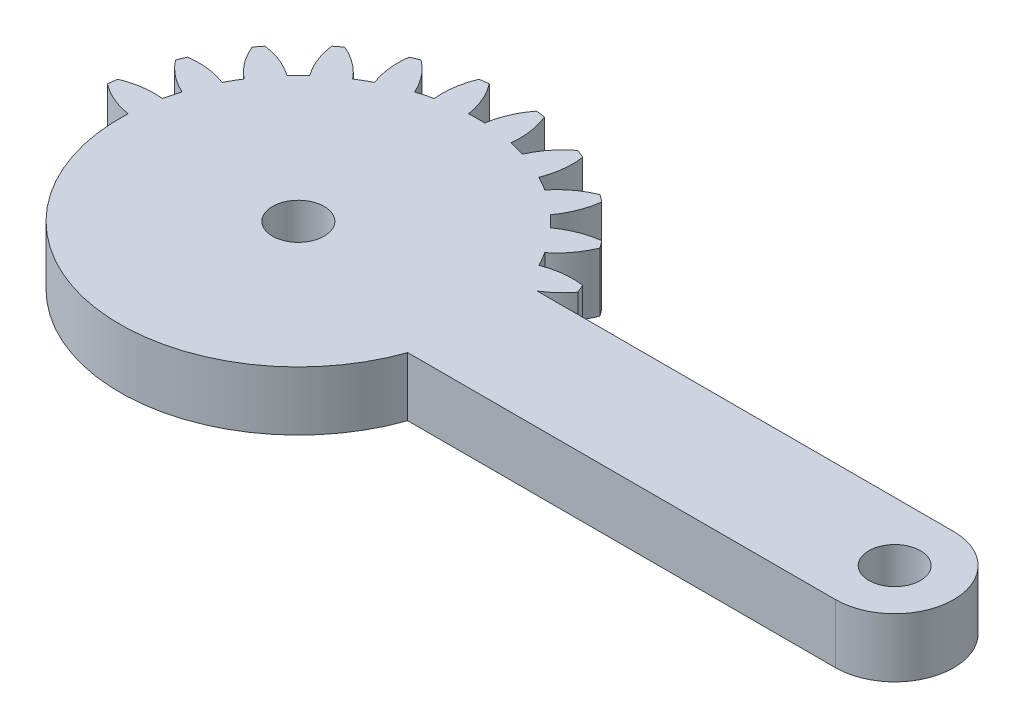
from build123d import *

# Parameters (mm, degrees)
SKETCH1_R           = 1.75
BOSS_EXTRUDE1_DEPTH = 4


with BuildPart() as part:
    # Sketch1 → Boss-Extrude1 (new body)
    with BuildSketch(Plane(origin=(0, 4, 0), x_dir=(1, 0, 0), z_dir=(0, 1, 0))):
        with BuildLine():
            Line((1.305695063, -4), (30.3065745, -4))
            ThreePointArc((30.3065745, -4), (34.3065745, 0), (30.3065745, 4))
            Line((30.3065745, 4), (2.081641936, 4))
            ThreePointArc((2.081641936, 4), (2.861028333, 4.588201733), (3.521749436, 5.30713988))
            ThreePointArc((3.521749436, 5.30713988), (3.405395609, 5.596745198), (3.282888305, 5.883801663))
            ThreePointArc((3.282888305, 5.883801663), (1.93527598, 5.894040025), (0.627094961, 5.57027124))
            ThreePointArc((0.627094961, 5.57027124), (0.366286148, 6.046375), (0.084372603, 6.510293938))
            ThreePointArc((0.084372603, 6.510293938), (1.018855105, 7.48132754), (1.683794586, 8.65351323))
            ThreePointArc((1.683794586, 8.65351323), (1.496450048, 8.903135899), (1.303821399, 9.148703928))
            ThreePointArc((1.303821399, 9.148703928), (-0.000522033, 8.809805691), (-1.180330337, 8.158486898))
            ThreePointArc((-1.180330337, 8.158486898), (-1.555477026, 8.550865528), (-1.947855656, 8.926012217))
            ThreePointArc((-1.947855656, 8.926012217), (-1.296536862, 10.105820521), (-0.957638625, 11.410163953))
            ThreePointArc((-0.957638625, 11.410163953), (-1.203206655, 11.602792602), (-1.452829324, 11.79013714))
            ThreePointArc((-1.452829324, 11.79013714), (-2.625015014, 11.125197659), (-3.596048616, 10.190715157))
            ThreePointArc((-3.596048616, 10.190715157), (-4.059967554, 10.472628702), (-4.536071314, 10.733437515))
            ThreePointArc((-4.536071314, 10.733437515), (-4.212302529, 12.041618533), (-4.222540891, 13.389230859))
            ThreePointArc((-4.222540891, 13.389230859), (-4.509597355, 13.511738163), (-4.799202674, 13.62809199))
            ThreePointArc((-4.799202674, 13.62809199), (-5.759348103, 12.682425791), (-6.455432668, 11.528463019))
            ThreePointArc((-6.455432668, 11.528463019), (-6.976508546, 11.680699536), (-7.503891752, 11.809396783))
            ThreePointArc((-7.503891752, 11.809396783), (-7.529737283, 13.156800143), (-7.888414517, 14.455843809))
            ThreePointArc((-7.888414517, 14.455843809), (-8.197396993, 14.499881098), (-8.507248835, 14.537314892))
            ThreePointArc((-8.507248835, 14.537314892), (-9.18992168, 13.375367565), (-9.563620196, 12.080565177))
            ThreePointArc((-9.563620196, 12.080565177), (-10.106342554, 12.09275), (-10.649064912, 12.080565177))
            ThreePointArc((-10.649064912, 12.080565177), (-11.022763428, 13.375367565), (-11.705436272, 14.537314892))
            ThreePointArc((-11.705436272, 14.537314892), (-12.015288115, 14.499881098), (-12.324270591, 14.455843809))
            ThreePointArc((-12.324270591, 14.455843809), (-12.682947825, 13.156800143), (-12.708793355, 11.809396783))
            ThreePointArc((-12.708793355, 11.809396783), (-13.236176561, 11.680699536), (-13.757252439, 11.528463019))
            ThreePointArc((-13.757252439, 11.528463019), (-14.453337005, 12.682425791), (-15.413482434, 13.62809199))
            ThreePointArc((-15.413482434, 13.62809199), (-15.703087752, 13.511738163), (-15.990144217, 13.389230859))
            ThreePointArc((-15.990144217, 13.389230859), (-16.000382579, 12.041618533), (-15.676613793, 10.733437515))
            ThreePointArc((-15.676613793, 10.733437515), (-16.152717554, 10.472628702), (-16.616636492, 10.190715157))
            ThreePointArc((-16.616636492, 10.190715157), (-17.587670094, 11.125197659), (-18.759855783, 11.79013714))
            ThreePointArc((-18.759855783, 11.79013714), (-19.009478453, 11.602792602), (-19.255046482, 11.410163953))
            ThreePointArc((-19.255046482, 11.410163953), (-18.916148245, 10.105820521), (-18.264829452, 8.926012217))
            ThreePointArc((-18.264829452, 8.926012217), (-18.657208082, 8.550865528), (-19.032354771, 8.158486898))
            ThreePointArc((-19.032354771, 8.158486898), (-20.212163074, 8.809805691), (-21.516506507, 9.148703928))
            ThreePointArc((-21.516506507, 9.148703928), (-21.709135156, 8.903135899), (-21.896479694, 8.65351323))
            ThreePointArc((-21.896479694, 8.65351323), (-21.231540213, 7.48132754), (-20.297057711, 6.510293938))
            ThreePointArc((-20.297057711, 6.510293938), (-20.578971255, 6.046375), (-20.839780068, 5.57027124))
            ThreePointArc((-20.839780068, 5.57027124), (-22.147961087, 5.894040025), (-23.495573413, 5.883801663))
            ThreePointArc((-23.495573413, 5.883801663), (-23.618080717, 5.596745198), (-23.734434544, 5.30713988))
            ThreePointArc((-23.734434544, 5.30713988), (-22.788768345, 4.346994451), (-21.634805572, 3.650909885))
            ThreePointArc((-21.634805572, 3.650909885), (-21.78704209, 3.129834008), (-21.915739337, 2.602450802))
            ThreePointArc((-21.915739337, 2.602450802), (-23.263142697, 2.576605271), (-24.562186363, 2.217928037))
            ThreePointArc((-24.562186363, 2.217928037), (-24.606223651, 1.908945561), (-24.643657446, 1.599093719))
            ThreePointArc((-24.643657446, 1.599093719), (-23.481710119, 0.916420874), (-22.186907731, 0.542722358))
            ThreePointArc((-22.186907731, 0.542722358), (-12.402167869, -11.872817218), (1.305695063, -4))
        make_face()
        with Locations(Location((30.3065745, 0, 0), (0, 0, 90))):
            Circle(SKETCH1_R, mode=Mode.SUBTRACT)
        with Locations(Location((-10.106342554, 0, 0), (0, 0, 90))):
            Circle(SKETCH1_R, mode=Mode.SUBTRACT)
    extrude(amount=-BOSS_EXTRUDE1_DEPTH)


solid = part.part
